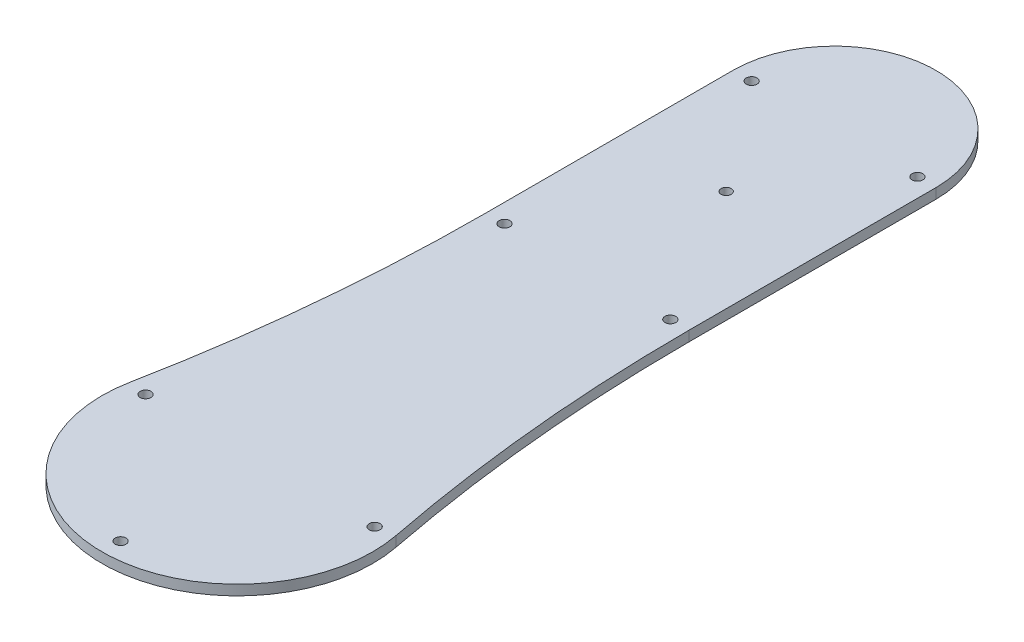
from build123d import *

# Parameters (mm, degrees)
EXTRUDE_1_DEPTH     = 3
SKETCH_2_R          = 1.6
CUT_EXTRUDE_1_DEPTH = 3
SKETCH_3_R          = 1.5
CUT_EXTRUDE_2_DEPTH = 10


with BuildPart() as part:
    # 草图1 → 凸台-拉伸1 (new body)
    with BuildSketch(Plane(origin=(0, 0, 0), x_dir=(1, 0, 0), z_dir=(0, 1, 0))):
        with BuildLine():
            Line((30, 176.457513111), (30, 103.440804328))
            ThreePointArc((30, 103.440804328), (32.320198134, 55.328281895), (39.259259259, 7.662281802))
            ThreePointArc((39.259259259, 7.662281802), (0, -40), (-39.259259259, 7.662281802))
            ThreePointArc((-39.259259259, 7.662281802), (-32.320198134, 55.328281895), (-30, 103.440804328))
            Line((-30, 103.440804328), (-30, 176.457513111))
            ThreePointArc((-30, 176.457513111), (0, 206.457513111), (30, 176.457513111))
        make_face()
    extrude(amount=EXTRUDE_1_DEPTH)

    # 草图2 → 切除-拉伸1 (cut)
    with BuildSketch(Plane(origin=(0, 3, 0), x_dir=(1, 0, 0), z_dir=(0, 1, 0))):
        with Locations(Location((0, -34.5, 0), (0, 0, 270))):
            Circle(SKETCH_2_R)
        with Locations(Location((33.842463041, 6.730809037, 0), (0, 0, 270))):
            Circle(SKETCH_2_R)
        with Locations(Location((24.500054413, 103.453580765, 0), (0, 0, 270))):
            Circle(SKETCH_2_R)
        with Locations(Location((24.500043559, 176.468944491, 0), (0, 0, 270))):
            Circle(SKETCH_2_R)
        with Locations(Location((-24.500043559, 176.468944491, 0), (0, 0, 90))):
            Circle(SKETCH_2_R)
        with Locations(Location((-24.500054413, 103.453580765, 0), (0, 0, 90))):
            Circle(SKETCH_2_R)
        with Locations(Location((-33.842463041, 6.730809037, 0), (0, 0, 90))):
            Circle(SKETCH_2_R)
    extrude(amount=-CUT_EXTRUDE_1_DEPTH, mode=Mode.SUBTRACT)

    # 草图3 → 切除-拉伸2 (cut)
    with BuildSketch(Plane(origin=(0, 3, 0), x_dir=(1, 0, 0), z_dir=(0, 1, 0))):
        with Locations(Location((0, 144.457513111, 0), (0, 0, 270))):
            Circle(SKETCH_3_R)
    extrude(amount=-CUT_EXTRUDE_2_DEPTH, mode=Mode.SUBTRACT)


solid = part.part
